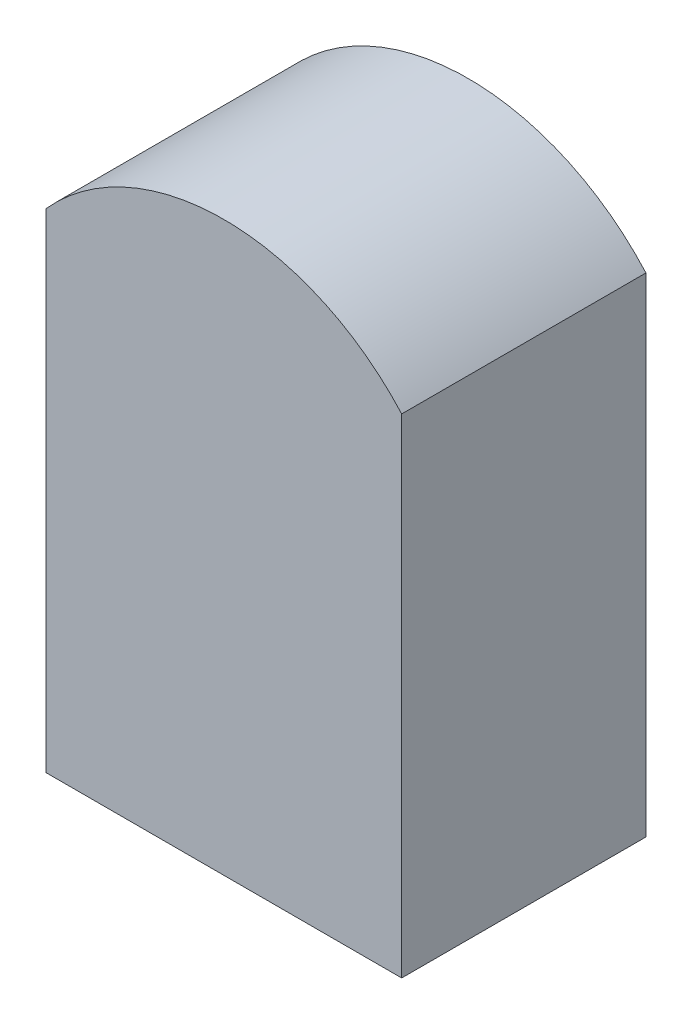
from build123d import *

# Parameters (mm, degrees)
BOSS_EXTRUDE2_DEPTH = 3.5


with BuildPart() as part:
    # Sketch1 → Boss-Extrude2 (new body)
    with BuildSketch(Plane.XY):
        with BuildLine():
            Line((0.006254552, 6.5), (0.006254552, -0.5))
            Line((0.006254552, -0.5), (5.102222701, -0.5))
            Line((5.102222701, -0.5), (5.102222701, 6.5))
            ThreePointArc((5.102222701, 6.5), (2.554238627, 7.640041694), (0.006254552, 6.5))
        make_face()
    extrude(amount=BOSS_EXTRUDE2_DEPTH)


solid = part.part
